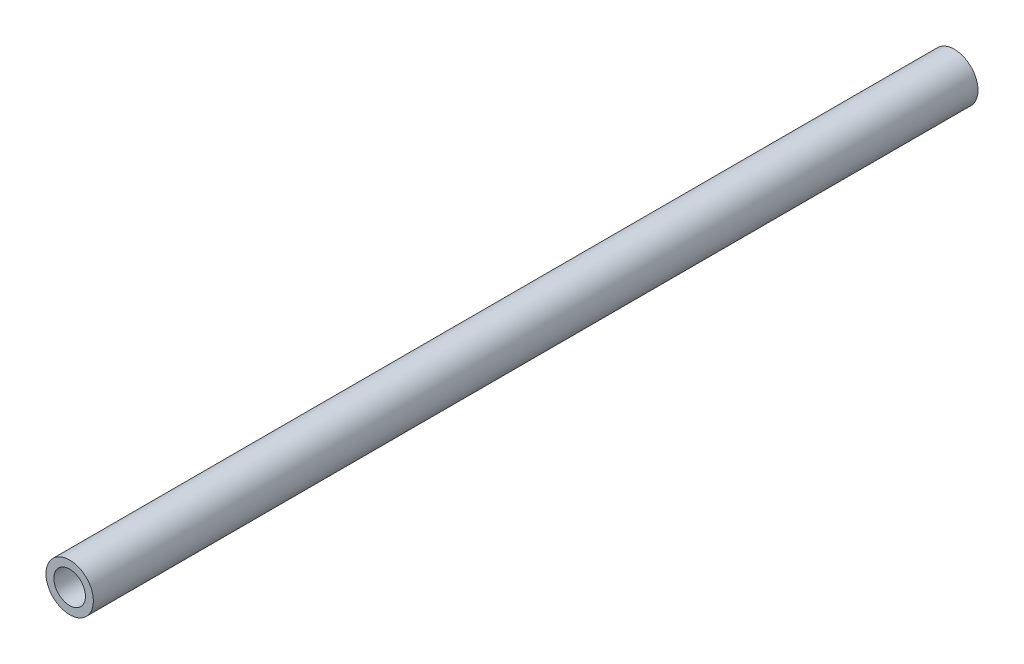
from build123d import *

# Parameters (mm, degrees)
SKETCH1_R           = 7.5
SKETCH1_R_2         = 5
BOSS_EXTRUDE1_DEPTH = 280


with BuildPart() as part:
    # Sketch1 → Boss-Extrude1 (new body)
    with BuildSketch(Plane.XY):
        Circle(SKETCH1_R)
        Circle(SKETCH1_R_2, mode=Mode.SUBTRACT)
    extrude(amount=BOSS_EXTRUDE1_DEPTH)


solid = part.part
